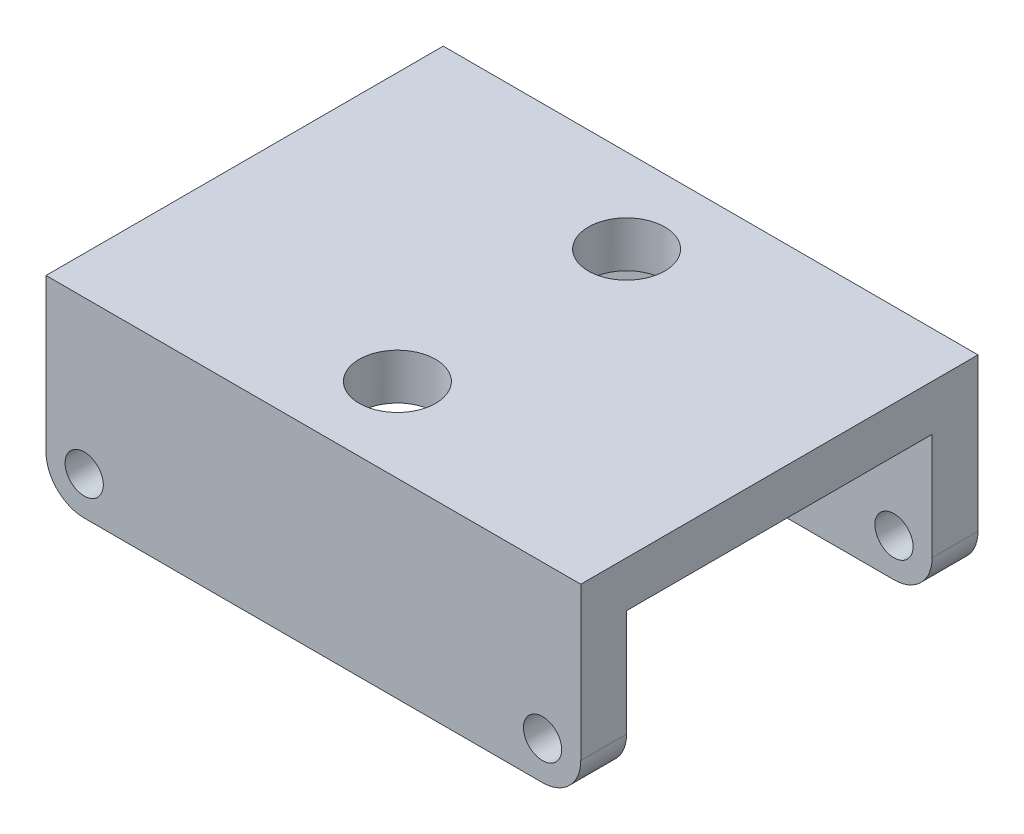
from build123d import *

# Parameters (mm, degrees)
SKETCH_1_W          = 70
SKETCH_1_H          = 25
SKETCH_1_R          = 2.5
EXTRUDE_1_DEPTH     = 52
FILLET_6_R          = 5
FILLET_7_R          = 5
SKETCH_2_W          = 40
SKETCH_2_H          = 19
CUT_EXTRUDE_2_DEPTH = 89.405565637
SKETCH_3_R          = 5
CUT_EXTRUDE_3_DEPTH = 75.906573986


with BuildPart() as part:
    # 草图1 → 凸台-拉伸1 (new body)
    with BuildSketch(Plane.XY):
        with Locations((-12.770229498, -2.044553468)):
            Rectangle(SKETCH_1_W, SKETCH_1_H)
        with Locations(Location((-42.770229498, -9.544553468, 0), (0, 0, 180))):
            Circle(SKETCH_1_R, mode=Mode.SUBTRACT)
        with Locations(Location((17.229770502, -9.544553468, 0), (0, 0, 180))):
            Circle(SKETCH_1_R, mode=Mode.SUBTRACT)
    extrude(amount=EXTRUDE_1_DEPTH)

    # 圆角6
    fillet_6_edges = [part.edges().sort_by_distance(p)[0] for p in [
        (-47.770229498, -14.544553468, 26),
    ]]
    fillet(fillet_6_edges, radius=FILLET_6_R)

    # 圆角7
    fillet_7_edges = [part.edges().sort_by_distance(p)[0] for p in [
        (22.229770502, -14.544553468, 26),
    ]]
    fillet(fillet_7_edges, radius=FILLET_7_R)

    # 草图2 → 切除-拉伸2 (cut, through all)
    with BuildSketch(Plane.ZY.offset(47.770229498)):
        with Locations((26, -5.044553468)):
            Rectangle(SKETCH_2_W, SKETCH_2_H)
    extrude(amount=-CUT_EXTRUDE_2_DEPTH, mode=Mode.SUBTRACT)

    # 草图3 → 切除-拉伸3 (cut, through all)
    with BuildSketch(Plane(origin=(0, 10.455446532, 0), x_dir=(1, 0, 0), z_dir=(0, 1, 0))):
        with Locations(Location((-12.770229498, -11, 0), (0, 0, 180))):
            Circle(SKETCH_3_R)
        with Locations(Location((-12.770229498, -41, 0), (0, 0, 270))):
            Circle(SKETCH_3_R)
    extrude(amount=-CUT_EXTRUDE_3_DEPTH, mode=Mode.SUBTRACT)


solid = part.part
